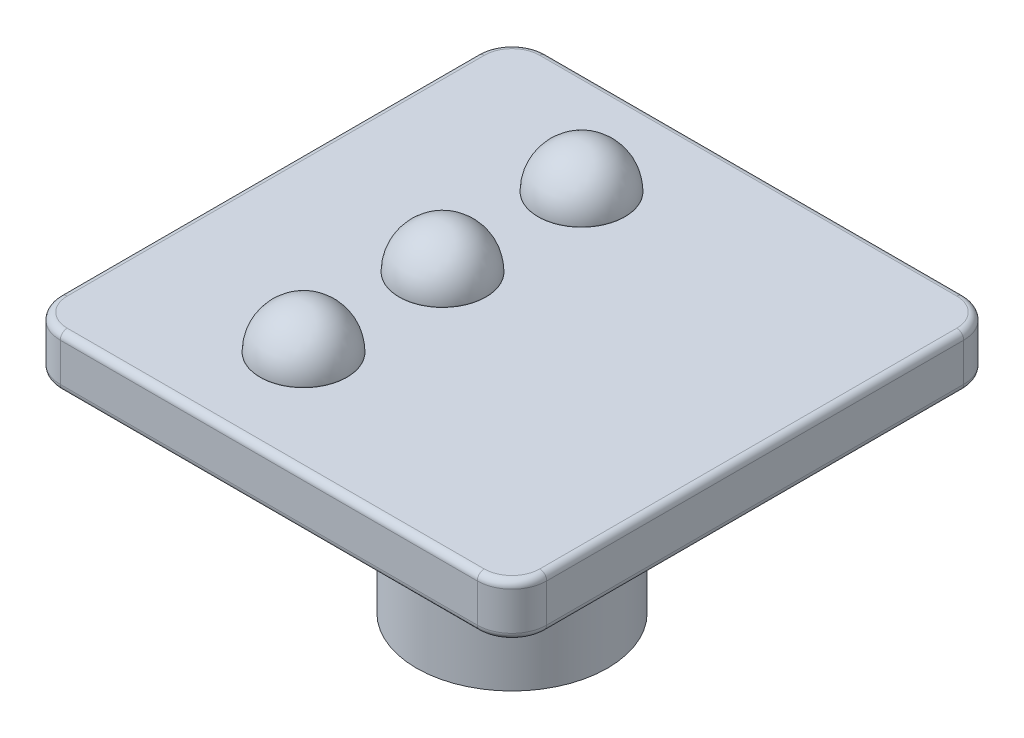
from build123d import *

# Parameters (mm, degrees)
BOSS_EXTRUDE1_DEPTH = 1.5
SKETCH2_R           = 2.75
BOSS_EXTRUDE2_DEPTH = 6
SKETCH3_W           = 1.1
SKETCH3_H           = 1.45
SKETCH3_W_2         = 1.45
SKETCH3_H_2         = 1.1
CUT_EXTRUDE1_DEPTH  = 6
CHAMFER1_SIZE       = 0.3
FILLET1_R           = 1
SKETCH4_R           = 1.25
BOSS_EXTRUDE3_DEPTH = 0.01
DOME1_FACE_RADIUS   = 1.25
DOME1_HEIGHT        = 1.25
DOME3_FACE_RADIUS   = 1.25
DOME3_HEIGHT        = 1.25
DOME5_FACE_RADIUS   = 1.25
DOME5_HEIGHT        = 1.25
FILLET3_R           = 0.2


with BuildPart() as part:
    # Sketch1 → Boss-Extrude1 (new body)
    with BuildSketch(Plane(origin=(0, 0, 0), x_dir=(1, 0, 0), z_dir=(0, 1, 0))):
        with BuildLine():
            Line((-7.324675649, 4.396717546), (4.675324351, 4.396717546))
            ThreePointArc((4.675324351, 4.396717546), (5.382431132, 4.103824327), (5.675324351, 3.396717546))
            Line((5.675324351, 3.396717546), (5.675324351, -8.603282454))
            ThreePointArc((5.675324351, -8.603282454), (5.382431132, -9.310389235), (4.675324351, -9.603282454))
            Line((4.675324351, -9.603282454), (-7.324675649, -9.603282454))
            ThreePointArc((-7.324675649, -9.603282454), (-8.03178243, -9.310389235), (-8.324675649, -8.603282454))
            Line((-8.324675649, -8.603282454), (-8.324675649, 3.396717546))
            ThreePointArc((-8.324675649, 3.396717546), (-8.03178243, 4.103824327), (-7.324675649, 4.396717546))
        make_face()
    extrude(amount=BOSS_EXTRUDE1_DEPTH)

    # Sketch2 → Boss-Extrude2 (add)
    with BuildSketch(Plane.XZ):
        with Locations(Location((-1.324675649, 2.603282454, 0), (0, 0, 270))):
            Circle(SKETCH2_R)
    extrude(amount=BOSS_EXTRUDE2_DEPTH)

    # Sketch3 → Cut-Extrude1 (cut)
    with BuildSketch(Plane.XZ.offset(6)):
        with Locations((-1.324675649, 3.878282454)):
            Rectangle(SKETCH3_W, SKETCH3_H)
        with Locations((-0.049675649, 2.603282454)):
            Rectangle(SKETCH3_W_2, SKETCH3_H_2)
        with Locations((-1.324675649, 2.603282454)):
            Rectangle(SKETCH3_W, SKETCH3_H_2)
        with Locations((-2.599675649, 2.603282454)):
            Rectangle(SKETCH3_W_2, SKETCH3_H_2)
        with Locations((-1.324675649, 1.328282454)):
            Rectangle(SKETCH3_W, SKETCH3_H)
    extrude(amount=-CUT_EXTRUDE1_DEPTH, mode=Mode.SUBTRACT)

    # Chamfer1
    chamfer1_edges = [part.edges().sort_by_distance(p)[0] for p in [
        (-0.774675649, -6, 3.878282454),
        (-0.049675649, -6, 3.153282454),
        (0.675324351, -6, 2.603282454),
        (-0.774675649, -6, 1.328282454),
        (-2.599675649, -6, 3.153282454),
        (-1.324675649, -6, 4.603282454),
        (-1.874675649, -6, 3.878282454),
        (-3.324675649, -6, 2.603282454),
        (-2.599675649, -6, 2.053282454),
        (-1.874675649, -6, 1.328282454),
        (-1.324675649, -6, 0.603282454),
        (-0.049675649, -6, 2.053282454),
    ]]
    chamfer(chamfer1_edges, length=CHAMFER1_SIZE)

    # Fillet1
    fillet1_edges = [part.edges().sort_by_distance(p)[0] for p in [
        (-1.324675649, 0, 5.353282454),
    ]]
    fillet(fillet1_edges, radius=FILLET1_R)

    # Sketch4 → Boss-Extrude3 (add)
    with BuildSketch(Plane(origin=(0, 1.5, 0), x_dir=(1, 0, 0), z_dir=(0, 1, 0))):
        with Locations(Location((-3.324675649, 1.396717546, 0), (0, 0, 90))):
            Circle(SKETCH4_R)
        with Locations(Location((-3.324675649, -2.603282454, 0), (0, 0, 90))):
            Circle(SKETCH4_R)
        with Locations(Location((-3.324675649, -6.603282454, 0), (0, 0, 90))):
            Circle(SKETCH4_R)
    extrude(amount=BOSS_EXTRUDE3_DEPTH)

    # Dome1: a dome of height H over a round flat face of radius A is a cap of a sphere of radius (A * A + H * H) / (2 * H)
    dome1_r = (DOME1_FACE_RADIUS * DOME1_FACE_RADIUS + DOME1_HEIGHT * DOME1_HEIGHT) / (2 * DOME1_HEIGHT)
    dome1_base = Plane((-3.324675649, 1.51, -1.396717546), z_dir=(0, 1, 0))
    with Locations(dome1_base.offset(DOME1_HEIGHT - dome1_r)):
        dome1_ball = Sphere(dome1_r, mode=Mode.PRIVATE)
    add(split(dome1_ball, bisect_by=dome1_base, keep=Keep.TOP, mode=Mode.PRIVATE))

    # Dome3: a dome of height H over a round flat face of radius A is a cap of a sphere of radius (A * A + H * H) / (2 * H)
    dome3_r = (DOME3_FACE_RADIUS * DOME3_FACE_RADIUS + DOME3_HEIGHT * DOME3_HEIGHT) / (2 * DOME3_HEIGHT)
    dome3_base = Plane((-3.324675649, 1.51, 2.603282454), z_dir=(0, 1, 0))
    with Locations(dome3_base.offset(DOME3_HEIGHT - dome3_r)):
        dome3_ball = Sphere(dome3_r, mode=Mode.PRIVATE)
    add(split(dome3_ball, bisect_by=dome3_base, keep=Keep.TOP, mode=Mode.PRIVATE))

    # Dome5: a dome of height H over a round flat face of radius A is a cap of a sphere of radius (A * A + H * H) / (2 * H)
    dome5_r = (DOME5_FACE_RADIUS * DOME5_FACE_RADIUS + DOME5_HEIGHT * DOME5_HEIGHT) / (2 * DOME5_HEIGHT)
    dome5_base = Plane((-3.324675649, 1.51, 6.603282454), z_dir=(0, 1, 0))
    with Locations(dome5_base.offset(DOME5_HEIGHT - dome5_r)):
        dome5_ball = Sphere(dome5_r, mode=Mode.PRIVATE)
    add(split(dome5_ball, bisect_by=dome5_base, keep=Keep.TOP, mode=Mode.PRIVATE))

    # Fillet3
    fillet3_edges = [part.edges().sort_by_distance(p)[0] for p in [
        (5.382431132, 1.5, 9.310389235),
        (-1.324675649, 0, 9.603282454),
        (-8.03178243, 0, 9.310389235),
        (5.675324351, 1.5, 2.603282454),
        (5.382431132, 1.5, -4.103824327),
        (-1.324675649, 1.5, -4.396717546),
        (-8.03178243, 1.5, -4.103824327),
        (-8.324675649, 1.5, 2.603282454),
        (-8.03178243, 1.5, 9.310389235),
        (-1.324675649, 1.5, 9.603282454),
        (-8.324675649, 0, 2.603282454),
        (-8.03178243, 0, -4.103824327),
        (-1.324675649, 0, -4.396717546),
        (5.382431132, 0, -4.103824327),
        (5.675324351, 0, 2.603282454),
        (5.382431132, 0, 9.310389235),
    ]]
    fillet(fillet3_edges, radius=FILLET3_R)


solid = part.part
